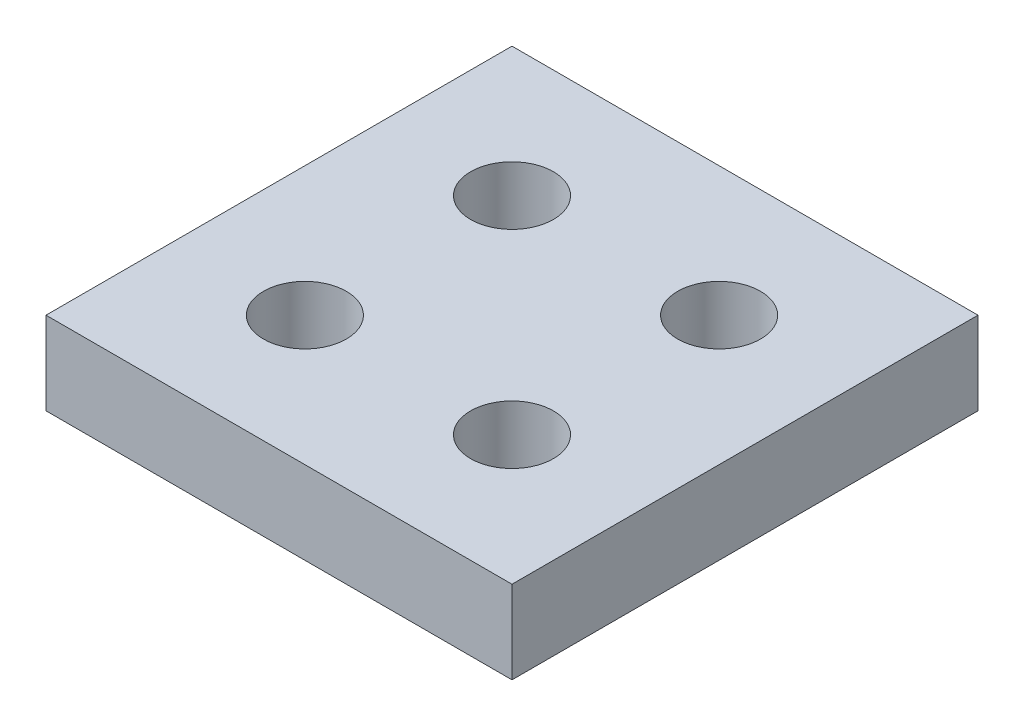
from build123d import *

# Parameters (mm, degrees)
SKETCH_1_W      = 4.5
SKETCH_1_H      = 4.5
SKETCH_1_R      = 0.4
EXTRUDE_1_DEPTH = 0.8


with BuildPart() as part:
    # 草图1 → 凸台-拉伸1 (new body)
    with BuildSketch(Plane(origin=(0, 0, 0), x_dir=(1, 0, 0), z_dir=(0, 1, 0))):
        Rectangle(SKETCH_1_W, SKETCH_1_H)
        with Locations(Location((-1, 1, 0), (0, 0, 270))):
            Circle(SKETCH_1_R, mode=Mode.SUBTRACT)
        with Locations(Location((1, 1, 0), (0, 0, 270))):
            Circle(SKETCH_1_R, mode=Mode.SUBTRACT)
        with Locations(Location((1, -1, 0), (0, 0, 270))):
            Circle(SKETCH_1_R, mode=Mode.SUBTRACT)
        with Locations(Location((-1, -1, 0), (0, 0, 270))):
            Circle(SKETCH_1_R, mode=Mode.SUBTRACT)
    extrude(amount=EXTRUDE_1_DEPTH)


solid = part.part
